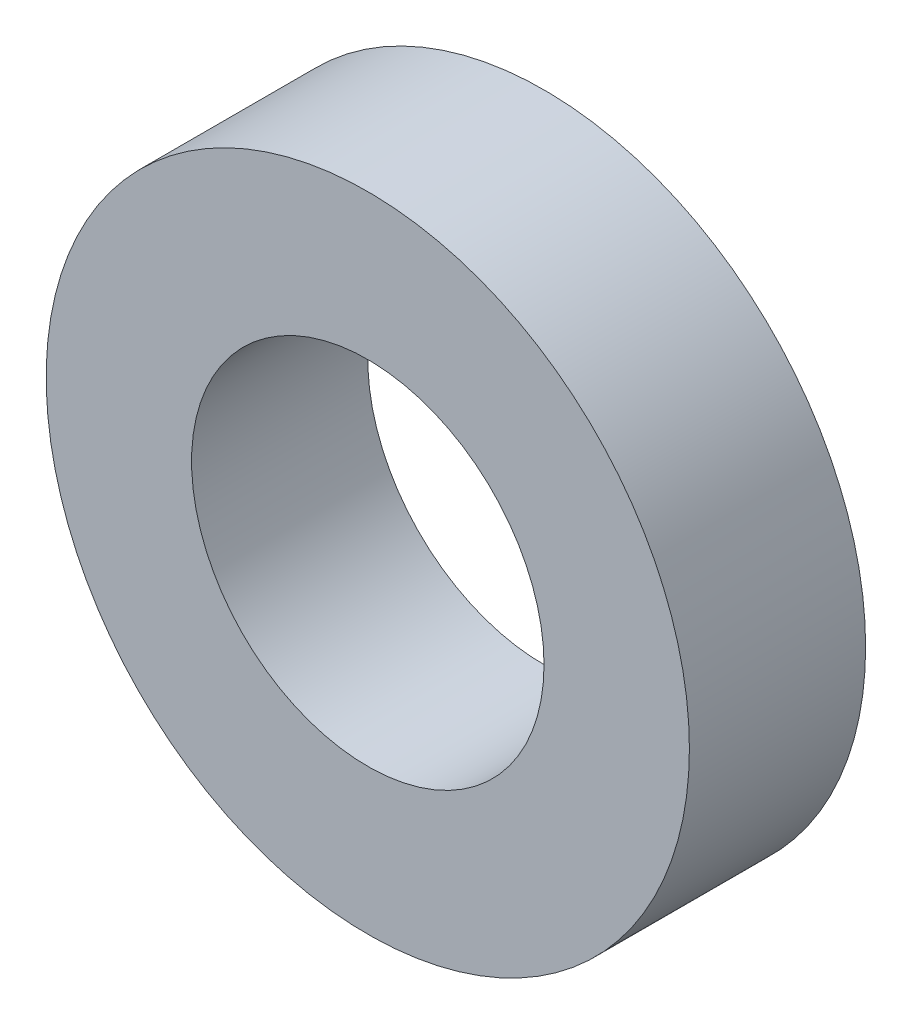
from build123d import *

# Parameters (mm, degrees)
SKETCH1_R           = 3.65
SKETCH1_R_2         = 2
BOSS_EXTRUDE1_DEPTH = 2


with BuildPart() as part:
    # Sketch1 → Boss-Extrude1 (new body)
    with BuildSketch(Plane(origin=(0, 34.703080777, 0), x_dir=(1, 0, 0), z_dir=(0, 0, 1))):
        with Locations((192.420533361, 258.678178666)):
            Circle(SKETCH1_R)
        with Locations((192.420533361, 258.678178666)):
            Circle(SKETCH1_R_2, mode=Mode.SUBTRACT)
    extrude(amount=BOSS_EXTRUDE1_DEPTH)


solid = part.part
